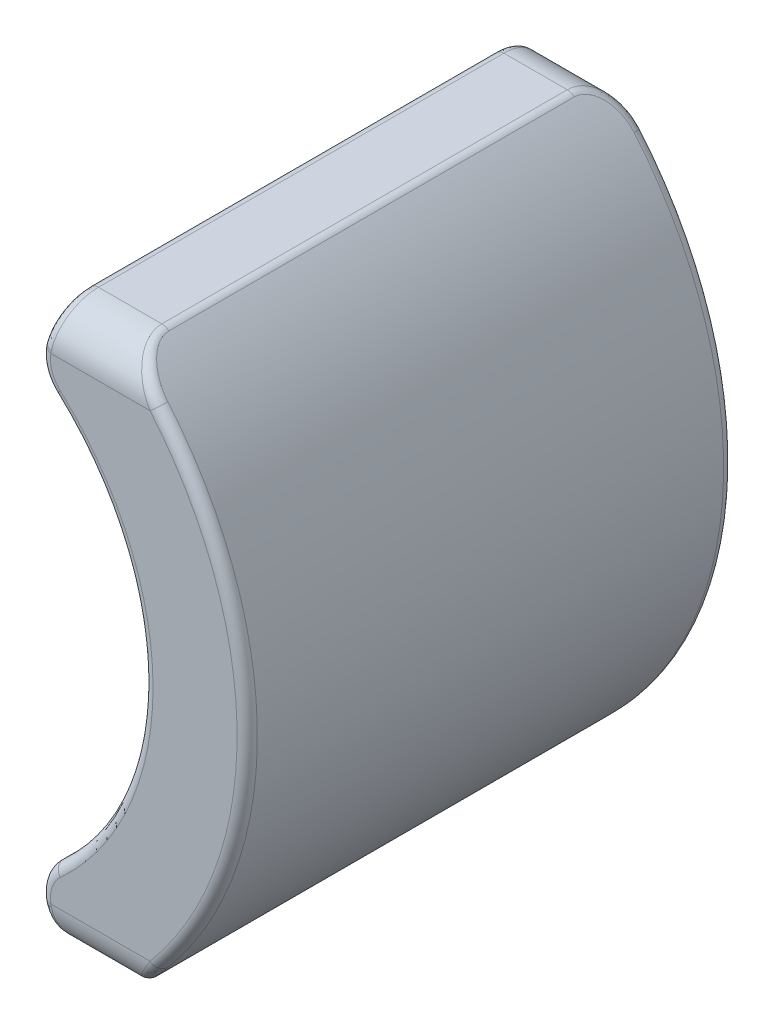
from build123d import *

# Parameters (mm, degrees)
BOSS_EXTRUDE1_DEPTH = 12
FILLET1_R           = 1
FILLET2_R           = 1
FILLET3_R           = 0.25


with BuildPart() as part:
    # Sketch1 → Boss-Extrude1 (new body)
    with BuildSketch(Plane.XY):
        with BuildLine():
            Line((6.621843031, -6.88), (4.761843031, -6.88))
            Line((4.761843031, -6.88), (4.415540745, -5.38))
            ThreePointArc((4.415540745, -5.38), (7.057327169, 0), (4.415540745, 5.38))
            Line((4.415540745, 5.38), (4.761843031, 6.88))
            Line((4.761843031, 6.88), (6.621843031, 6.88))
            ThreePointArc((6.621843031, 6.88), (9.63, 0), (6.621843031, -6.88))
        make_face()
    extrude(amount=BOSS_EXTRUDE1_DEPTH)

    # Fillet1
    fillet1_edges = [part.edges().sort_by_distance(p)[0] for p in [
        (4.415540745, -5.38, 6),
        (4.415540745, 5.38, 6),
    ]]
    fillet(fillet1_edges, radius=FILLET1_R)

    # Fillet2
    fillet2_edges = [part.edges().sort_by_distance(p)[0] for p in [
        (5.691843031, -6.88, 0),
        (5.691843031, -6.88, 12),
        (5.691843031, 6.88, 0),
        (5.691843031, 6.88, 12),
    ]]
    fillet(fillet2_edges, radius=FILLET2_R)

    # Fillet3
    fillet3_edges = [part.edges().sort_by_distance(p)[0] for p in [
        (7.057327169, 0, 0),
        (4.587679935, 5.407756591, 0),
        (7.057327169, 0, 12),
        (4.587679935, -5.407756591, 12),
        (6.621843031, -6.88, 6),
        (4.761843031, -6.88, 6),
        (9.63, 0, 0),
        (6.621843031, 6.88, 6),
        (9.63, 0, 12),
        (6.96895036, 6.541881603, 11.749608404),
        (6.96895036, 6.541881603, 0.250391596),
        (6.968950362, -6.541881601, 11.749608406),
        (6.968950361, -6.541881601, 0.250391595),
        (4.587679935, -5.407756591, 0),
        (4.543193477, -5.927755229, 11.998859068),
        (4.543193477, -5.927755229, 0.001140932),
        (4.700888568, -6.615977213, 11.677006308),
        (4.700888568, -6.615977213, 0.322993692),
        (4.587679935, 5.407756591, 12),
        (4.761843031, 6.88, 6),
        (4.700888568, 6.615977213, 11.677006308),
        (4.700888568, 6.615977213, 0.322993692),
        (4.543193495, 5.927755224, 11.998859044),
        (4.543193495, 5.927755224, 0.001140956),
    ]]
    fillet(fillet3_edges, radius=FILLET3_R)


solid = part.part
